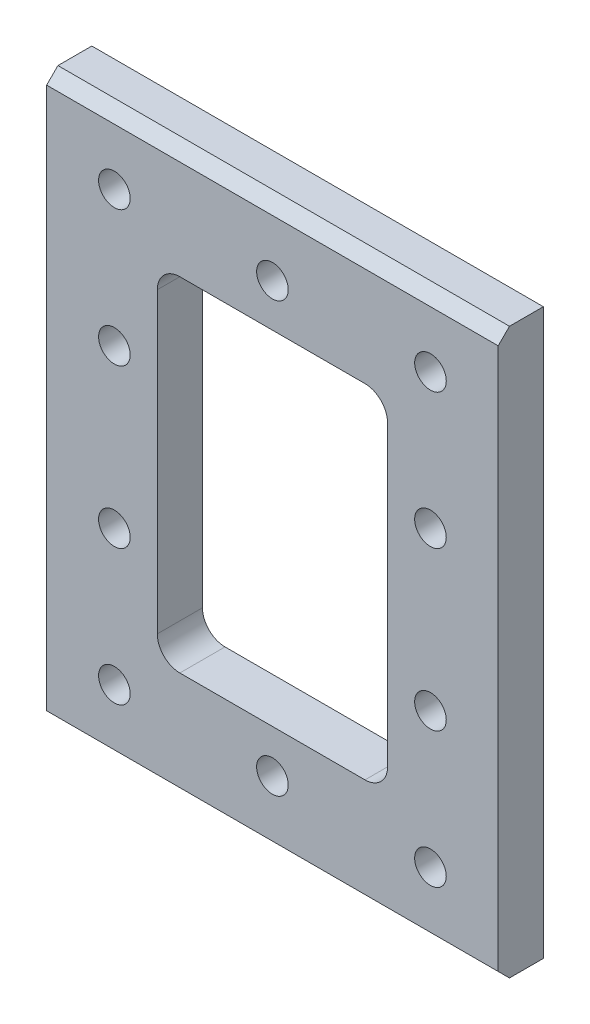
from build123d import *

# Parameters (mm, degrees)
SKETCH_1_W          = 200
SKETCH_1_H          = 250
EXTRUDE_1_DEPTH     = 20
CUT_EXTRUDE_1_REACH = 163.323
SKETCH_2_R          = 7
CHAMFER_1_SIZE      = 5


with BuildPart() as part:
    # 草图1 → 凸台-拉伸1 (new body)
    with BuildSketch(Plane.XY):
        Rectangle(SKETCH_1_W, SKETCH_1_H)
    extrude(amount=EXTRUDE_1_DEPTH)

    # 草图2 → 切除-拉伸1 (cut, up to next)
    with BuildSketch(Plane.XY.offset(20), mode=Mode.PRIVATE) as cut_extrude_1_sk1:
        with Locations((-70, 95)):
            Circle(SKETCH_2_R)
    cut_extrude_1_tool1 = extrude(cut_extrude_1_sk1.sketch, amount=-CUT_EXTRUDE_1_REACH, mode=Mode.PRIVATE) & part.part
    # 草图2 → 切除-拉伸1 (cut, up to next)
    with BuildSketch(Plane.XY.offset(20), mode=Mode.PRIVATE) as cut_extrude_1_sk2:
        with Locations((0, 95)):
            Circle(SKETCH_2_R)
    cut_extrude_1_tool2 = extrude(cut_extrude_1_sk2.sketch, amount=-CUT_EXTRUDE_1_REACH, mode=Mode.PRIVATE) & part.part
    # 草图2 → 切除-拉伸1 (cut, up to next)
    with BuildSketch(Plane.XY.offset(20), mode=Mode.PRIVATE) as cut_extrude_1_sk3:
        with Locations((70, 95)):
            Circle(SKETCH_2_R)
    cut_extrude_1_tool3 = extrude(cut_extrude_1_sk3.sketch, amount=-CUT_EXTRUDE_1_REACH, mode=Mode.PRIVATE) & part.part
    # 草图2 → 切除-拉伸1 (cut, up to next)
    with BuildSketch(Plane.XY.offset(20), mode=Mode.PRIVATE) as cut_extrude_1_sk4:
        with Locations((-70, 35)):
            Circle(SKETCH_2_R)
    cut_extrude_1_tool4 = extrude(cut_extrude_1_sk4.sketch, amount=-CUT_EXTRUDE_1_REACH, mode=Mode.PRIVATE) & part.part
    # 草图2 → 切除-拉伸1 (cut, up to next)
    with BuildSketch(Plane.XY.offset(20), mode=Mode.PRIVATE) as cut_extrude_1_sk5:
        with Locations((70, 35)):
            Circle(SKETCH_2_R)
    cut_extrude_1_tool5 = extrude(cut_extrude_1_sk5.sketch, amount=-CUT_EXTRUDE_1_REACH, mode=Mode.PRIVATE) & part.part
    # 草图2 → 切除-拉伸1 (cut, up to next)
    with BuildSketch(Plane.XY.offset(20), mode=Mode.PRIVATE) as cut_extrude_1_sk6:
        with Locations((-70, -35)):
            Circle(SKETCH_2_R)
    cut_extrude_1_tool6 = extrude(cut_extrude_1_sk6.sketch, amount=-CUT_EXTRUDE_1_REACH, mode=Mode.PRIVATE) & part.part
    # 草图2 → 切除-拉伸1 (cut, up to next)
    with BuildSketch(Plane.XY.offset(20), mode=Mode.PRIVATE) as cut_extrude_1_sk7:
        with Locations((0, -95)):
            Circle(SKETCH_2_R)
    cut_extrude_1_tool7 = extrude(cut_extrude_1_sk7.sketch, amount=-CUT_EXTRUDE_1_REACH, mode=Mode.PRIVATE) & part.part
    # 草图2 → 切除-拉伸1 (cut, up to next)
    with BuildSketch(Plane.XY.offset(20), mode=Mode.PRIVATE) as cut_extrude_1_sk8:
        with Locations((-70, -95)):
            Circle(SKETCH_2_R)
    cut_extrude_1_tool8 = extrude(cut_extrude_1_sk8.sketch, amount=-CUT_EXTRUDE_1_REACH, mode=Mode.PRIVATE) & part.part
    # 草图2 → 切除-拉伸1 (cut, up to next)
    with BuildSketch(Plane.XY.offset(20), mode=Mode.PRIVATE) as cut_extrude_1_sk9:
        with Locations((70, -35)):
            Circle(SKETCH_2_R)
    cut_extrude_1_tool9 = extrude(cut_extrude_1_sk9.sketch, amount=-CUT_EXTRUDE_1_REACH, mode=Mode.PRIVATE) & part.part
    # 草图2 → 切除-拉伸1 (cut, up to next)
    with BuildSketch(Plane.XY.offset(20), mode=Mode.PRIVATE) as cut_extrude_1_sk10:
        with Locations((70, -95)):
            Circle(SKETCH_2_R)
    cut_extrude_1_tool10 = extrude(cut_extrude_1_sk10.sketch, amount=-CUT_EXTRUDE_1_REACH, mode=Mode.PRIVATE) & part.part
    # 草图2 → 切除-拉伸1 (cut, up to next)
    with BuildSketch(Plane.XY.offset(20), mode=Mode.PRIVATE) as cut_extrude_1_sk11:
        with BuildLine():
            Line((-41, 76), (41, 76))
            ThreePointArc((41, 76), (48.071067812, 73.071067812), (51, 66))
            Line((51, 66), (51, -66))
            ThreePointArc((51, -66), (48.071067812, -73.071067812), (41, -76))
            Line((41, -76), (-41, -76))
            ThreePointArc((-41, -76), (-48.071067812, -73.071067812), (-51, -66))
            Line((-51, -66), (-51, 66))
            ThreePointArc((-51, 66), (-48.071067812, 73.071067812), (-41, 76))
        make_face()
    cut_extrude_1_tool11 = extrude(cut_extrude_1_sk11.sketch, amount=-CUT_EXTRUDE_1_REACH, mode=Mode.PRIVATE) & part.part
    add(cut_extrude_1_tool1.solids().sort_by_distance((-70, 95, 20))[0], mode=Mode.SUBTRACT)
    add(cut_extrude_1_tool2.solids().sort_by_distance((0, 95, 20))[0], mode=Mode.SUBTRACT)
    add(cut_extrude_1_tool3.solids().sort_by_distance((70, 95, 20))[0], mode=Mode.SUBTRACT)
    add(cut_extrude_1_tool4.solids().sort_by_distance((-70, 35, 20))[0], mode=Mode.SUBTRACT)
    add(cut_extrude_1_tool5.solids().sort_by_distance((70, 35, 20))[0], mode=Mode.SUBTRACT)
    add(cut_extrude_1_tool6.solids().sort_by_distance((-70, -35, 20))[0], mode=Mode.SUBTRACT)
    add(cut_extrude_1_tool7.solids().sort_by_distance((0, -95, 20))[0], mode=Mode.SUBTRACT)
    add(cut_extrude_1_tool8.solids().sort_by_distance((-70, -95, 20))[0], mode=Mode.SUBTRACT)
    add(cut_extrude_1_tool9.solids().sort_by_distance((70, -35, 20))[0], mode=Mode.SUBTRACT)
    add(cut_extrude_1_tool10.solids().sort_by_distance((70, -95, 20))[0], mode=Mode.SUBTRACT)
    add(cut_extrude_1_tool11.solids().sort_by_distance((0, 0, 20))[0], mode=Mode.SUBTRACT)

    # 倒角1
    chamfer_1_edges = [part.edges().sort_by_distance(p)[0] for p in [
        (0, -125, 20),
        (0, 125, 20),
    ]]
    chamfer(chamfer_1_edges, length=CHAMFER_1_SIZE)


solid = part.part
